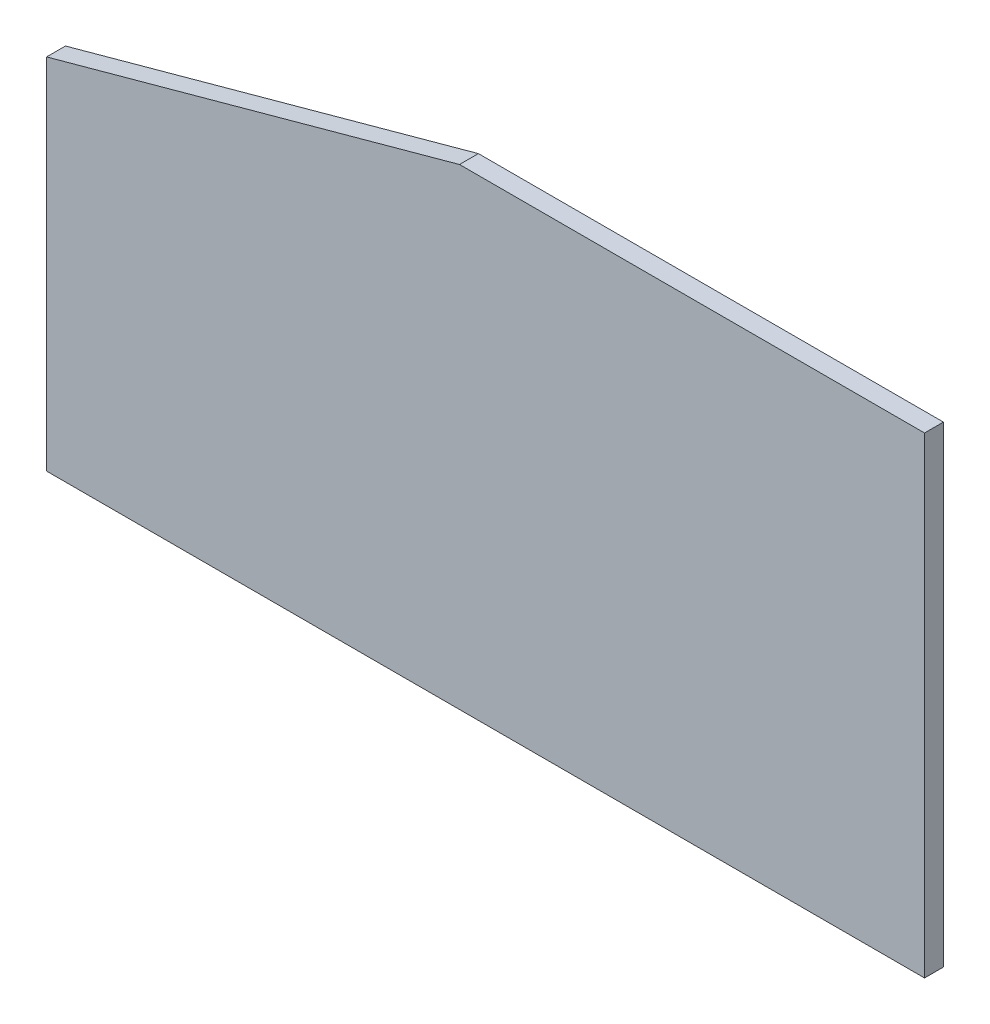
from build123d import *

# Parameters (mm, degrees)
BOSS_EXTRUDE1_DEPTH = 5


with BuildPart() as part:
    # Sketch1 → Boss-Extrude1 (new body)
    with BuildSketch(Plane.XY):
        Polygon((-389.523809524, -57.291666667), (-157.023809524, -57.291666667), (-157.023809524, 67.708333333), (-280.176608285, 67.708333333), (-389.523809524, 37.708333333), align=None)
    extrude(amount=BOSS_EXTRUDE1_DEPTH)


solid = part.part
